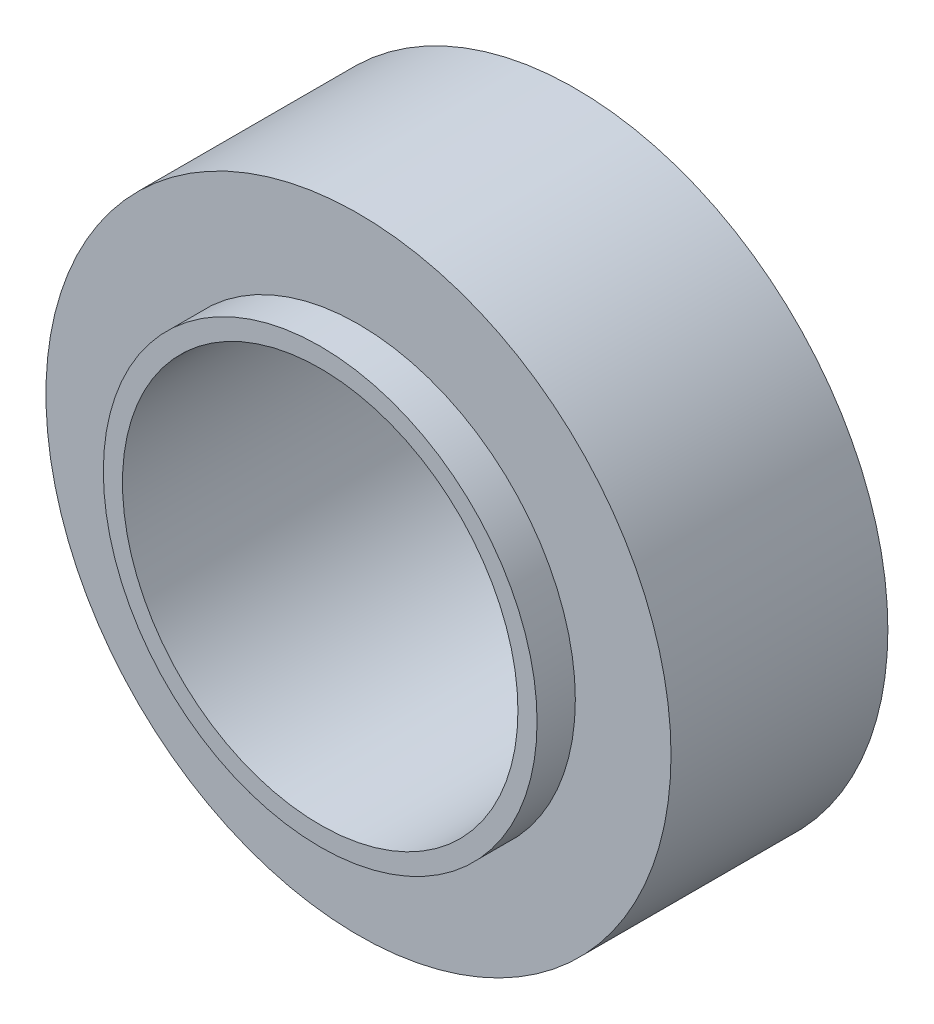
from build123d import *

# Parameters (mm, degrees)
SCHIZZO1_R        = 49
SCHIZZO1_R_2      = 31
ESTRUSIONE1_DEPTH = 23
SCHIZZO4_W        = 15
SCHIZZO4_H        = 6


with BuildPart() as part:
    # Schizzo1 → Estrusione1 (new, symmetric)
    with BuildSketch(Plane.XY):
        Circle(SCHIZZO1_R)
        Circle(SCHIZZO1_R_2, mode=Mode.SUBTRACT)
    extrude(amount=ESTRUSIONE1_DEPTH, both=True)

    # Schizzo4 → Taglia-Rivoluzione1 (revolve, cut)
    with BuildSketch(Plane(origin=(0, 0, 0), x_dir=(1, 0, 0), z_dir=(0, 1, 0))):
        with Locations((41.5, 20)):
            Rectangle(SCHIZZO4_W, SCHIZZO4_H)
        with Locations((41.5, -20)):
            Rectangle(SCHIZZO4_W, SCHIZZO4_H)
    revolve(axis=Axis((0, 0, 23), (0, 0, -1)), mode=Mode.SUBTRACT)


solid = part.part
